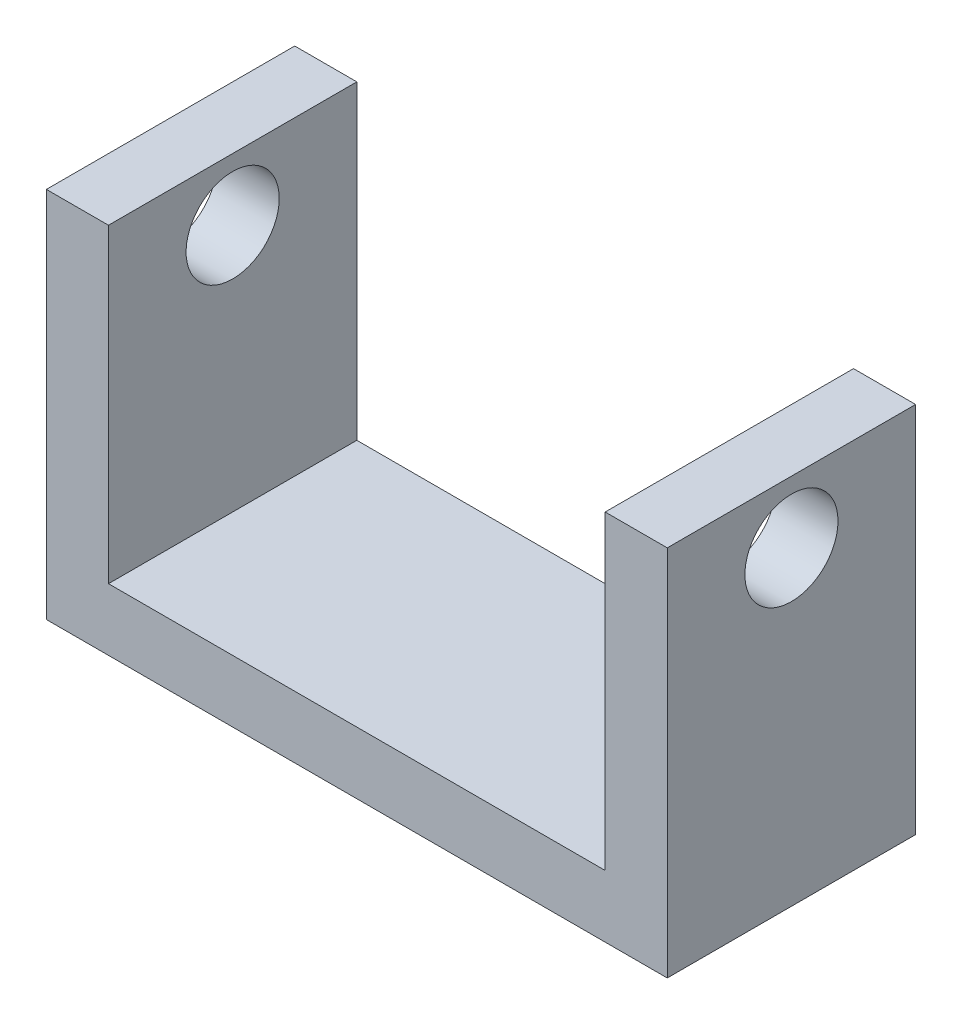
from build123d import *

# Parameters (mm, degrees)
SKETCH1_W                      = 12.7
SKETCH1_H                      = 19.05
BOSS_EXTRUDE1_DEPTH            = 31.75
CUT_EXTRUDE1_REACH             = 41.144
SKETCH2_W                      = 25.4
SKETCH2_H                      = 15.875
F_3_16_0_1875_DIAMETER_HOLE1_D = 4.7625


with BuildPart() as part:
    # Sketch1 → Boss-Extrude1 (new body)
    with BuildSketch(Plane(origin=(0, 0, 0), x_dir=(0, 0, -1), z_dir=(1, 0, 0))):
        with Locations((6.35, 9.525)):
            Rectangle(SKETCH1_W, SKETCH1_H)
    extrude(amount=BOSS_EXTRUDE1_DEPTH)

    # Sketch2 → Cut-Extrude1 (cut, up to next)
    with BuildSketch(Plane.XY, mode=Mode.PRIVATE) as cut_extrude1_sk1:
        with Locations((15.875, 11.1125)):
            Rectangle(SKETCH2_W, SKETCH2_H)
    cut_extrude1_tool1 = extrude(cut_extrude1_sk1.sketch, amount=-CUT_EXTRUDE1_REACH, mode=Mode.PRIVATE) & part.part
    add(cut_extrude1_tool1.solids().sort_by_distance((15.875, 11.1125, 0))[0], mode=Mode.SUBTRACT)

    # 3/16 (0.1875) Diameter Hole1 (through all)
    with Locations(Plane(origin=(31.75, 0, 0), x_dir=(0, 0, -1), z_dir=(1, 0, 0))):
        with Locations((6.35, 15.875)):
            Hole(F_3_16_0_1875_DIAMETER_HOLE1_D / 2)


solid = part.part
